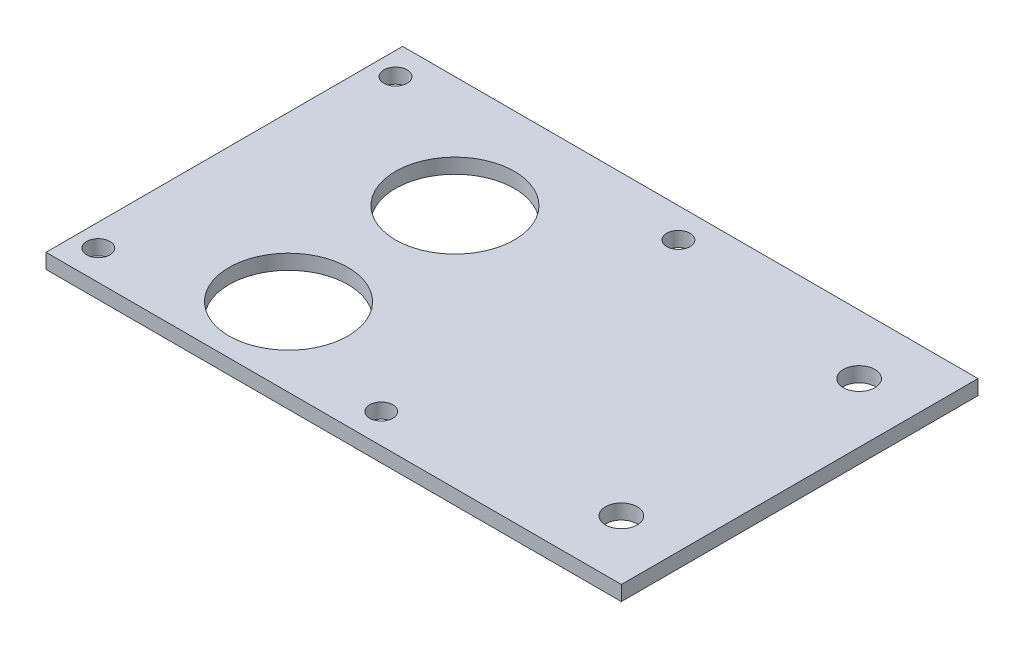
from build123d import *

# Parameters (mm, degrees)
SKETCH2_W                    = 122.936
SKETCH2_H                    = 76.2
BOSS_EXTRUDE1_DEPTH          = 3.175
F_10_0_1935_DIAMETER_HOLE1_D = 4.9784
LPATTERN1_COUNT              = 2
LPATTERN1_PITCH              = 60.452
F_1_4_0_25_DIAMETER_HOLE1_D  = 6.7564
MIRROR1_COPY_1_D             = 4.9784
SKETCH7_R                    = 12.7
CUT_EXTRUDE1_DEPTH           = 145.67128506


with BuildPart() as part:
    # Sketch2 → Boss-Extrude1 (new body)
    with BuildSketch(Plane(origin=(0, 0, 0), x_dir=(1, 0, 0), z_dir=(0, 1, 0))):
        with Locations((61.468, 38.1)):
            Rectangle(SKETCH2_W, SKETCH2_H)
    extrude(amount=BOSS_EXTRUDE1_DEPTH)

    # #10 (0.1935) Diameter Hole1 (through all)
    with Locations(Plane(origin=(0, 3.175, 0), x_dir=(1, 0, 0), z_dir=(0, 1, 0))):
        with Locations((4.826, 69.85)):
            f_10_0_1935_diameter_hole1 = Hole(F_10_0_1935_DIAMETER_HOLE1_D / 2)

    # LPattern1: #10 (0.1935) Diameter Hole1 ×2
    with Locations(*[(i * LPATTERN1_PITCH, 0, 0) for i in range(1, LPATTERN1_COUNT)]):
        add(f_10_0_1935_diameter_hole1, mode=Mode.SUBTRACT)

    # 1/4 (0.25) Diameter Hole1 (through all)
    with Locations(Plane(origin=(0, 3.175, 0), x_dir=(1, 0, 0), z_dir=(0, 1, 0))):
        with Locations((110.236, 63.5)):
            f_1_4_0_25_diameter_hole1 = Hole(F_1_4_0_25_DIAMETER_HOLE1_D / 2)

    # Mirror1: #10 (0.1935) Diameter Hole1, 1/4 (0.25) Diameter Hole1 across plane
    add(f_10_0_1935_diameter_hole1.mirror(Plane(origin=(0, 0, -38.1), x_dir=(1, 0, 0), z_dir=(0, 0, -1))), mode=Mode.SUBTRACT)
    add(f_1_4_0_25_diameter_hole1.mirror(Plane(origin=(0, 0, -38.1), x_dir=(1, 0, 0), z_dir=(0, 0, -1))), mode=Mode.SUBTRACT)

    # Mirror1 copy 1 (through all)
    with Locations(Plane(origin=(60.452, 3.175, -76.2), x_dir=(1, 0, 0), z_dir=(0, 1, 0))):
        with Locations((4.826, -69.85)):
            Hole(MIRROR1_COPY_1_D / 2)

    # Sketch7 → Cut-Extrude1 (cut, through all)
    with BuildSketch(Plane(origin=(0, 3.175, 0), x_dir=(1, 0, 0), z_dir=(0, 1, 0))):
        with Locations(Location((35.052, 16.764, 0), (0, 0, 270))):
            Circle(SKETCH7_R)
        with Locations(Location((35.052, 52.324, 0), (0, 0, 270))):
            Circle(SKETCH7_R)
    extrude(amount=-CUT_EXTRUDE1_DEPTH, mode=Mode.SUBTRACT)


solid = part.part
